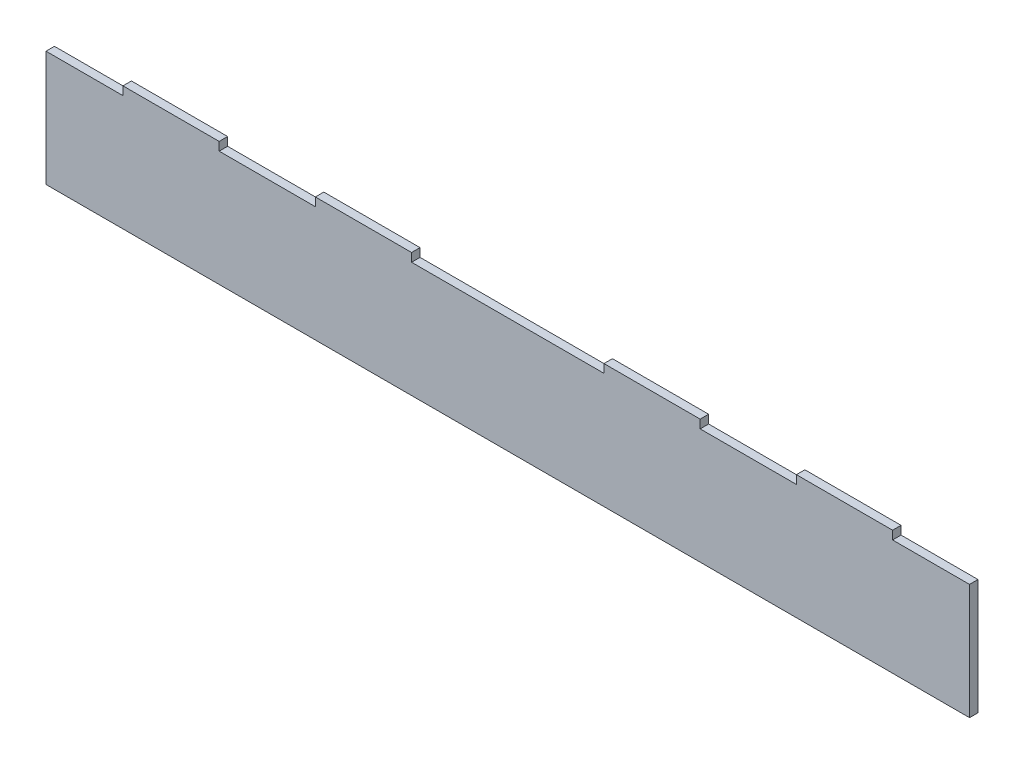
from build123d import *

# Parameters (mm, degrees)
BOSS_EXTRUDE1_DEPTH = 5.588


with BuildPart() as part:
    # Sketch1 → Boss-Extrude1 (new body)
    with BuildSketch(Plane.XY):
        Polygon((73.603498171, 76.081986728), (124.403498171, 76.081986728), (124.403498171, 81.669986728), (187.903498171, 81.669986728), (187.903498171, 76.081986728), (251.403498171, 76.081986728), (251.403498171, 81.669986728), (314.903498171, 81.669986728), (314.903498171, 76.081986728), (441.903498171, 76.081986728), (441.903498171, 81.669986728), (505.403498171, 81.669986728), (505.403498171, 76.081986728), (568.903498171, 76.081986728), (568.903498171, 81.669986728), (632.403498171, 81.669986728), (632.403498171, 76.081986728), (683.203498171, 76.081986728), (683.203498171, -0.118013272), (73.603498171, -0.118013272), align=None)
    extrude(amount=BOSS_EXTRUDE1_DEPTH)


solid = part.part
